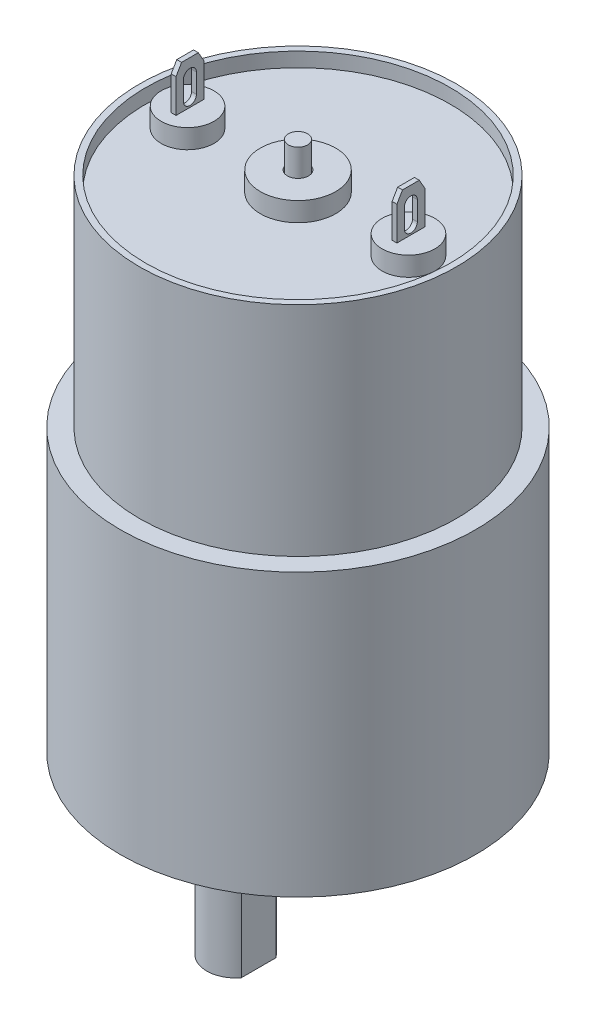
from build123d import *
from OCP.BRepFilletAPI import BRepFilletAPI_MakeChamfer

# Parameters (mm, degrees)
SCHIZZO1_R                   = 18.5
ESTRUSIONE_ESTRUSIONE1_DEPTH = 29.3
SCHIZZO2_R                   = 16.5
ESTRUSIONE_ESTRUSIONE2_DEPTH = 22.7
SCHIZZO3_R                   = 15.85
TAGLIO_ESTRUSIONE1_DEPTH     = 1.5
SCHIZZO4_R                   = 2.75
SCHIZZO4_R_2                 = 3.925
ESTRUSIONE_ESTRUSIONE3_DEPTH = 2
SCHIZZO5_W                   = 0.5
SCHIZZO5_H                   = 2.9
ESTRUSIONE_ESTRUSIONE4_DEPTH = 4.5
SMUSSO1_SIZE                 = 1
SMUSSO1_SIZE2                = 0.577350269
TAGLIO_ESTRUSIONE2_DEPTH     = 68.129073433
SCHIZZO7_R                   = 1.1
TAGLIO_ESTRUSIONE3_DEPTH     = 2
SCHIZZO8_R                   = 1
ESTRUSIONE_ESTRUSIONE5_DEPTH = 4.75
SCHIZZO9_R                   = 1.5
TAGLIO_ESTRUSIONE4_DEPTH     = 5
SCHIZZO10_R                  = 6
ESTRUSIONE_ESTRUSIONE6_DEPTH = 6
SCHIZZO11_R                  = 3
ESTRUSIONE_ESTRUSIONE7_DEPTH = 3.5
ESTRUSIONE_ESTRUSIONE8_DEPTH = 12
CROQUIS1_R                   = 2
CORTAR_EXTRUIR1_DEPTH        = 10


with BuildPart() as part:
    # Schizzo1 → Estrusione-Estrusione1 (new body)
    with BuildSketch(Plane(origin=(0, 0, 0), x_dir=(1, 0, 0), z_dir=(0, 1, 0))):
        with Locations(Location((0, 0, 0), (0, 0, 270))):
            Circle(SCHIZZO1_R)
    extrude(amount=ESTRUSIONE_ESTRUSIONE1_DEPTH)

    # Schizzo2 → Estrusione-Estrusione2 (add)
    with BuildSketch(Plane(origin=(0, 29.3, 0), x_dir=(1, 0, 0), z_dir=(0, 1, 0))):
        with Locations(Location((0, 0, 0), (0, 0, 270))):
            Circle(SCHIZZO2_R)
    extrude(amount=ESTRUSIONE_ESTRUSIONE2_DEPTH)

    # Schizzo3 → Taglio-Estrusione1 (cut)
    with BuildSketch(Plane(origin=(0, 52, 0), x_dir=(1, 0, 0), z_dir=(0, 1, 0))):
        with Locations(Location((0, 0, 0), (0, 0, 270))):
            Circle(SCHIZZO3_R)
    extrude(amount=-TAGLIO_ESTRUSIONE1_DEPTH, mode=Mode.SUBTRACT)

    # Schizzo4 → Estrusione-Estrusione3 (add)
    with BuildSketch(Plane(origin=(0, 50.5, 0), x_dir=(1, 0, 0), z_dir=(0, 1, 0))):
        with Locations(Location((11.5, 0, 0), (0, 0, 270))):
            Circle(SCHIZZO4_R)
        with Locations(Location((-11.5, 0, 0), (0, 0, 270))):
            Circle(SCHIZZO4_R)
        with Locations(Location((0, 0, 0), (0, 0, 270))):
            Circle(SCHIZZO4_R_2)
    extrude(amount=ESTRUSIONE_ESTRUSIONE3_DEPTH)

    # Schizzo5 → Estrusione-Estrusione4 (add)
    with BuildSketch(Plane(origin=(0, 52.5, 0), x_dir=(1, 0, 0), z_dir=(0, 1, 0))):
        with Locations((-11.5, 0)):
            Rectangle(SCHIZZO5_W, SCHIZZO5_H)
        with Locations((11.5, 0)):
            Rectangle(SCHIZZO5_W, SCHIZZO5_H)
    extrude(amount=ESTRUSIONE_ESTRUSIONE4_DEPTH)

    # Smusso1: one chamfer whose edges measure the first distance from different faces: ONE call of the kernel's chamfer builder (chamfer() names one face for all edges)
    smusso1_edges_1 = [part.edges().sort_by_distance(p)[0] for p in [
        (-11.5, 57, -1.45),
    ]]
    smusso1_side_1 = [part.faces().sort_by_distance(p)[0] for p in [
        (-11.5, 54.75, -1.45),
    ]]
    smusso1_edges_2 = [part.edges().sort_by_distance(p)[0] for p in [
        (-11.5, 57, 1.45),
    ]]
    smusso1_side_2 = [part.faces().sort_by_distance(p)[0] for p in [
        (-11.5, 54.75, 1.45),
    ]]
    smusso1_edges_3 = [part.edges().sort_by_distance(p)[0] for p in [
        (11.5, 57, -1.45),
    ]]
    smusso1_side_3 = [part.faces().sort_by_distance(p)[0] for p in [
        (11.5, 54.75, -1.45),
    ]]
    smusso1_edges_4 = [part.edges().sort_by_distance(p)[0] for p in [
        (11.5, 57, 1.45),
    ]]
    smusso1_side_4 = [part.faces().sort_by_distance(p)[0] for p in [
        (11.5, 54.75, 1.45),
    ]]
    smusso1 = BRepFilletAPI_MakeChamfer(part.part.solid().wrapped)
    for e in smusso1_edges_1:
        smusso1.Add(SMUSSO1_SIZE, SMUSSO1_SIZE2, e.wrapped, smusso1_side_1[0].wrapped)  # the first distance lies on this face
    for e in smusso1_edges_2:
        smusso1.Add(SMUSSO1_SIZE, SMUSSO1_SIZE2, e.wrapped, smusso1_side_2[0].wrapped)  # the first distance lies on this face
    for e in smusso1_edges_3:
        smusso1.Add(SMUSSO1_SIZE, SMUSSO1_SIZE2, e.wrapped, smusso1_side_3[0].wrapped)  # the first distance lies on this face
    for e in smusso1_edges_4:
        smusso1.Add(SMUSSO1_SIZE, SMUSSO1_SIZE2, e.wrapped, smusso1_side_4[0].wrapped)  # the first distance lies on this face
    add(Compound.cast(smusso1.Shape()), mode=Mode.REPLACE)

    # Schizzo6 → Taglio-Estrusione2 (cut, through all)
    with BuildSketch(Plane.ZY.offset(11.75)):
        with BuildLine():
            Line((0.675, 55.35), (0.675, 53.35))
            ThreePointArc((0.675, 53.35), (0, 52.675), (-0.675, 53.35))
            Line((-0.675, 53.35), (-0.675, 55.35))
            ThreePointArc((-0.675, 55.35), (0, 56.025), (0.675, 55.35))
        make_face()
    extrude(amount=-TAGLIO_ESTRUSIONE2_DEPTH, mode=Mode.SUBTRACT)

    # Schizzo7 → Taglio-Estrusione3 (cut)
    with BuildSketch(Plane(origin=(0, 52.5, 0), x_dir=(1, 0, 0), z_dir=(0, 1, 0))):
        with Locations(Location((0, 0, 0), (0, 0, 270))):
            Circle(SCHIZZO7_R)
    extrude(amount=-TAGLIO_ESTRUSIONE3_DEPTH, mode=Mode.SUBTRACT)

    # Schizzo8 → Estrusione-Estrusione5 (add)
    with BuildSketch(Plane(origin=(0, 50.5, 0), x_dir=(1, 0, 0), z_dir=(0, 1, 0))):
        with Locations(Location((0, 0, 0), (0, 0, 270))):
            Circle(SCHIZZO8_R)
    extrude(amount=ESTRUSIONE_ESTRUSIONE5_DEPTH)

    # Schizzo9 → Taglio-Estrusione4 (cut)
    with BuildSketch(Plane.XZ):
        with Locations(Location((0, -15.5, 0), (0, 0, 270))):
            Circle(SCHIZZO9_R)
        with Locations(Location((-13.423393759, -7.75, 0), (0, 0, 270))):
            Circle(SCHIZZO9_R)
        with Locations(Location((-13.423393759, 7.75, 0), (0, 0, 270))):
            Circle(SCHIZZO9_R)
        with Locations(Location((0, 15.5, 0), (0, 0, 270))):
            Circle(SCHIZZO9_R)
        with Locations(Location((13.423393759, 7.75, 0), (0, 0, 270))):
            Circle(SCHIZZO9_R)
        with Locations(Location((13.423393759, -7.75, 0), (0, 0, 270))):
            Circle(SCHIZZO9_R)
    extrude(amount=-TAGLIO_ESTRUSIONE4_DEPTH, mode=Mode.SUBTRACT)

    # Schizzo10 → Estrusione-Estrusione6 (add)
    with BuildSketch(Plane.XZ):
        with Locations(Location((-6.5, 0, 0), (0, 0, 270))):
            Circle(SCHIZZO10_R)
    extrude(amount=ESTRUSIONE_ESTRUSIONE6_DEPTH)

    # Schizzo11 → Estrusione-Estrusione7 (add)
    with BuildSketch(Plane.XZ.offset(6)):
        with Locations(Location((-6.5, 0, 0), (0, 0, 270))):
            Circle(SCHIZZO11_R)
    extrude(amount=ESTRUSIONE_ESTRUSIONE7_DEPTH)

    # Schizzo12 → Estrusione-Estrusione8 (add)
    with BuildSketch(Plane.XZ.offset(9.5)):
        with BuildLine():
            ThreePointArc((-9.5, 0), (-7.448683298, -2.846049894), (-4.1, -1.8))
            Line((-4.1, -1.8), (-4.1, 0))
            Line((-4.1, 0), (-9.5, 0))
        make_face()
        with BuildLine():
            Line((-9.5, 0), (-4.1, 0))
            Line((-4.1, 0), (-4.1, 1.8))
            ThreePointArc((-4.1, 1.8), (-7.448683298, 2.846049894), (-9.5, 0))
        make_face()
    extrude(amount=ESTRUSIONE_ESTRUSIONE8_DEPTH)

    # Croquis1 → Cortar-Extruir1 (cut)
    with BuildSketch(Plane.XZ):
        with Locations(Location((7.75, -13.423393759, 0), (0, 0, 270))):
            Circle(CROQUIS1_R)
        with Locations(Location((-15.5, 0, 0), (0, 0, 270))):
            Circle(CROQUIS1_R)
        with Locations(Location((7.75, 13.423393759, 0), (0, 0, 270))):
            Circle(CROQUIS1_R)
    extrude(amount=-CORTAR_EXTRUIR1_DEPTH, mode=Mode.SUBTRACT)


solid = part.part
